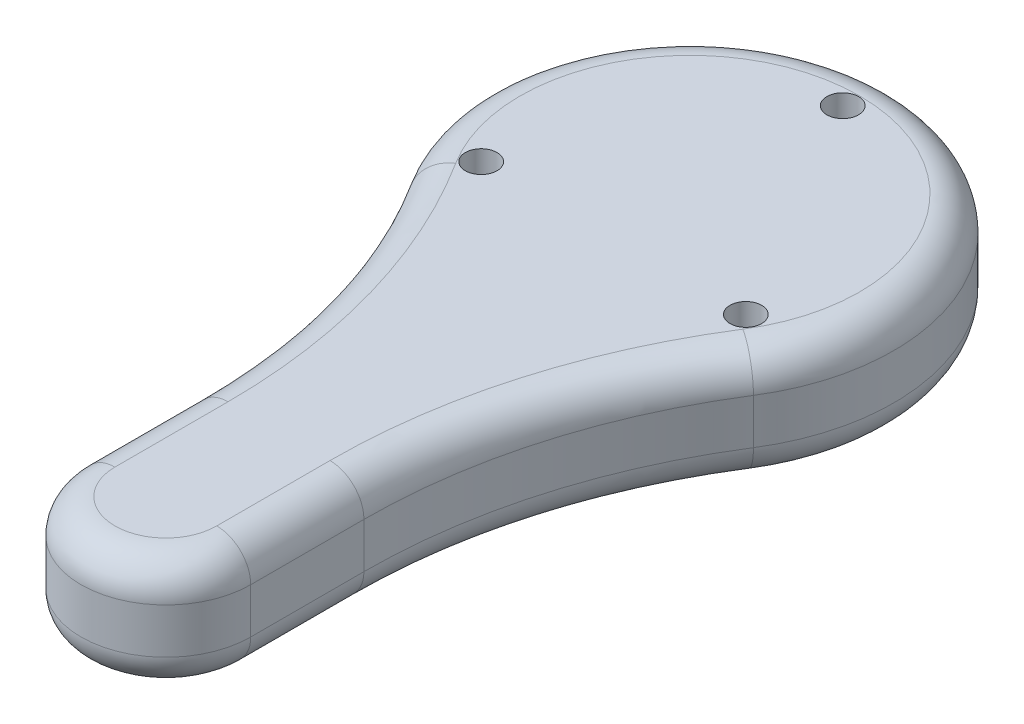
from build123d import *

# Parameters (mm, degrees)
BOSS_EXTRUDE1_DEPTH = 10
FILLET1_R           = 3
SKETCH2_R           = 1.4
CUT_EXTRUDE1_DEPTH  = 58.606674312


with BuildPart() as part:
    # Sketch1 → Boss-Extrude1 (new body)
    with BuildSketch(Plane(origin=(0, 0, 0), x_dir=(1, 0, 0), z_dir=(0, 1, 0))):
        with BuildLine():
            Line((7.5, -36.300826437), (7.5, -46.300826437))
            ThreePointArc((7.5, -46.300826437), (0, -53.800826437), (-7.5, -46.300826437))
            Line((-7.5, -46.300826437), (-7.5, -36.300826437))
            ThreePointArc((-7.5, -36.300826437), (-9.468913253, -22.407853181), (-15.220588235, -9.609042292))
            ThreePointArc((-15.220588235, -9.609042292), (0, 18), (15.220588235, -9.609042292))
            ThreePointArc((15.220588235, -9.609042292), (9.468913253, -22.407853181), (7.5, -36.300826437))
        make_face()
    extrude(amount=BOSS_EXTRUDE1_DEPTH)

    # Fillet1
    fillet1_edges = [part.edges().sort_by_distance(p)[0] for p in [
        (-9.468913253, 10, 22.407853181),
        (-7.5, 10, 41.300826437),
        (0, 10, 53.800826437),
        (7.5, 10, 41.300826437),
        (9.468913253, 10, 22.407853181),
        (7.5, 0, 41.300826437),
        (0, 0, 53.800826437),
        (-7.5, 0, 41.300826437),
        (-9.468913253, 0, 22.407853181),
        (0, 0, -18),
        (9.468913253, 0, 22.407853181),
        (0, 10, -18),
    ]]
    fillet(fillet1_edges, radius=FILLET1_R)

    # Sketch2 → Cut-Extrude1 (cut, through all)
    with BuildSketch(Plane(origin=(0, 10, 0), x_dir=(1, 0, 0), z_dir=(0, 1, 0))):
        with Locations(Location((0, 13.5, 0), (0, 0, 270))):
            Circle(SKETCH2_R)
        with Locations(Location((-11.691342951, -6.75, 0), (0, 0, 270))):
            Circle(SKETCH2_R)
        with Locations(Location((11.691342951, -6.75, 0), (0, 0, 270))):
            Circle(SKETCH2_R)
    extrude(amount=-CUT_EXTRUDE1_DEPTH, mode=Mode.SUBTRACT)


solid = part.part
